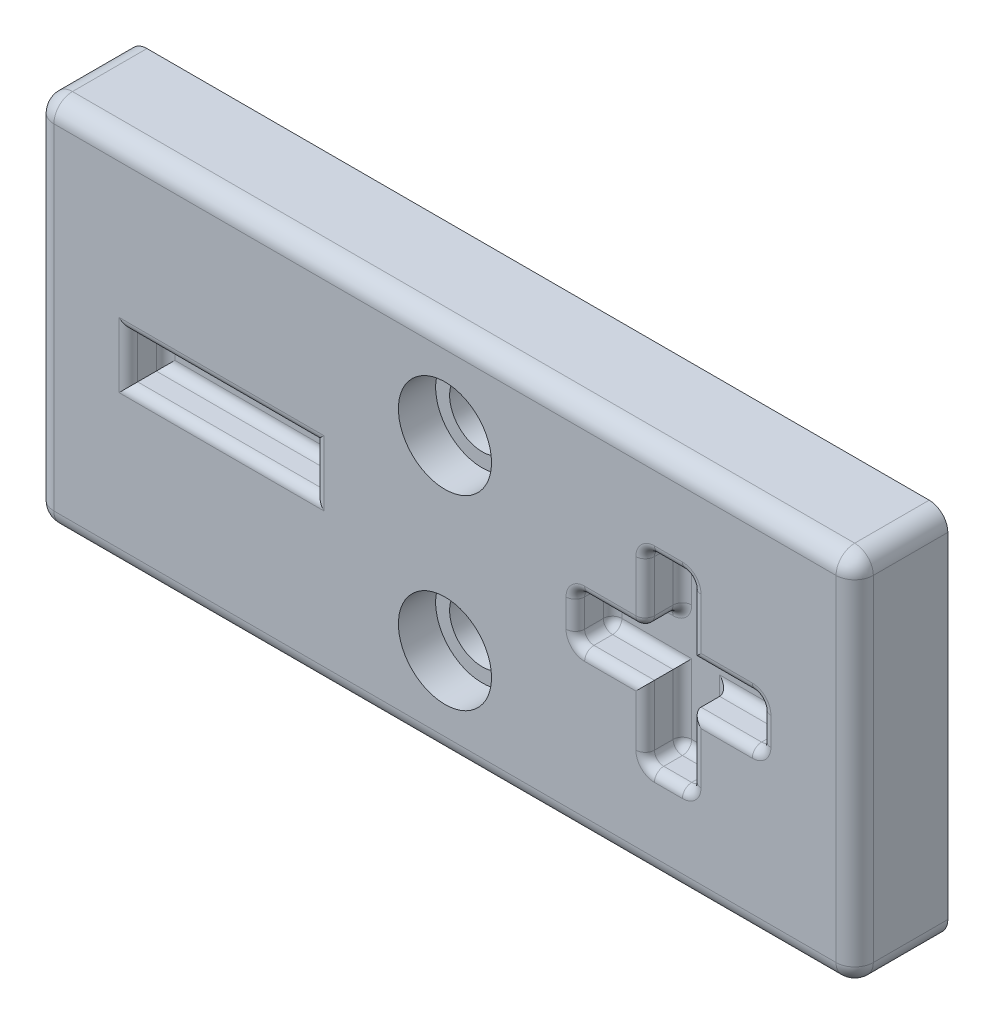
from build123d import *

# Parameters (mm, degrees)
SKETCH1_W           = 44
SKETCH1_H           = 20
BOSS_EXTRUDE1_DEPTH = 5
CUT_EXTRUDE1_REACH  = 50.59
SKETCH2_R           = 1.75
SKETCH3_R           = 2.5
CUT_EXTRUDE2_DEPTH  = 2
SKETCH4_W           = 10
SKETCH4_H           = 2.5
CUT_EXTRUDE3_DEPTH  = 2
FILLET1_R           = 1
FILLET2_R           = 0.5


with BuildPart() as part:
    # Sketch1 → Boss-Extrude1 (new body)
    with BuildSketch(Plane.XY):
        with Locations((22, 10)):
            Rectangle(SKETCH1_W, SKETCH1_H)
    extrude(amount=BOSS_EXTRUDE1_DEPTH)

    # Sketch2 → Cut-Extrude1 (cut, up to next)
    with BuildSketch(Plane.XY.offset(5), mode=Mode.PRIVATE) as cut_extrude1_sk1:
        with Locations((22, 15)):
            Circle(SKETCH2_R)
    cut_extrude1_tool1 = extrude(cut_extrude1_sk1.sketch, amount=-CUT_EXTRUDE1_REACH, mode=Mode.PRIVATE) & part.part
    # Sketch2 → Cut-Extrude1 (cut, up to next)
    with BuildSketch(Plane.XY.offset(5), mode=Mode.PRIVATE) as cut_extrude1_sk2:
        with Locations((22, 5)):
            Circle(SKETCH2_R)
    cut_extrude1_tool2 = extrude(cut_extrude1_sk2.sketch, amount=-CUT_EXTRUDE1_REACH, mode=Mode.PRIVATE) & part.part
    add(cut_extrude1_tool1.solids().sort_by_distance((22, 15, 5))[0], mode=Mode.SUBTRACT)
    add(cut_extrude1_tool2.solids().sort_by_distance((22, 5, 5))[0], mode=Mode.SUBTRACT)

    # Sketch3 → Cut-Extrude2 (cut)
    with BuildSketch(Plane.XY.offset(5)):
        with Locations((22, 15)):
            Circle(SKETCH3_R)
        with Locations((22, 5)):
            Circle(SKETCH3_R)
    extrude(amount=-CUT_EXTRUDE2_DEPTH, mode=Mode.SUBTRACT)

    # Sketch4 → Cut-Extrude3 (cut)
    with BuildSketch(Plane.XY.offset(5)):
        with Locations((10, 10)):
            Rectangle(SKETCH4_W, SKETCH4_H)
        Polygon((32.75, 5), (32.75, 8.75), (29, 8.75), (29, 11.25), (32.75, 11.25), (32.75, 15), (35.25, 15), (35.25, 11.25), (39, 11.25), (39, 8.75), (35.25, 8.75), (35.25, 5), align=None)
    extrude(amount=-CUT_EXTRUDE3_DEPTH, mode=Mode.SUBTRACT)

    # Fillet1
    fillet1_edges = [part.edges().sort_by_distance(p)[0] for p in [
        (44, 10, 5),
        (22, 20, 5),
        (0, 10, 5),
        (0, 20, 2.5),
        (44, 20, 2.5),
        (44, 0, 2.5),
        (0, 0, 2.5),
        (22, 0, 5),
    ]]
    fillet(fillet1_edges, radius=FILLET1_R)

    # Fillet2
    fillet2_edges = [part.edges().sort_by_distance(p)[0] for p in [
        (10, 11.25, 3),
        (15, 10, 3),
        (10, 8.75, 3),
        (5, 10, 3),
        (10, 11.25, 5),
        (5, 10, 5),
        (10, 8.75, 5),
        (15, 10, 5),
        (29, 10, 3),
        (29, 8.75, 4),
        (30.875, 11.25, 3),
        (29, 11.25, 4),
        (32.75, 13.125, 3),
        (32.75, 11.25, 4),
        (34, 15, 3),
        (32.75, 15, 4),
        (35.25, 13.125, 3),
        (35.25, 15, 4),
        (37.125, 11.25, 3),
        (39, 10, 3),
        (39, 11.25, 4),
        (37.125, 8.75, 3),
        (39, 8.75, 4),
        (35.25, 6.875, 3),
        (34, 5, 3),
        (35.25, 5, 4),
        (32.75, 6.875, 3),
        (32.75, 5, 4),
        (30.875, 8.75, 3),
        (29, 10, 5),
        (30.875, 8.75, 5),
        (32.75, 6.875, 5),
        (34, 5, 5),
        (35.25, 6.875, 5),
        (37.125, 8.75, 5),
        (39, 10, 5),
        (37.125, 11.25, 5),
        (35.25, 13.125, 5),
        (34, 15, 5),
        (32.75, 13.125, 5),
        (30.875, 11.25, 5),
    ]]
    fillet(fillet2_edges, radius=FILLET2_R)


solid = part.part
